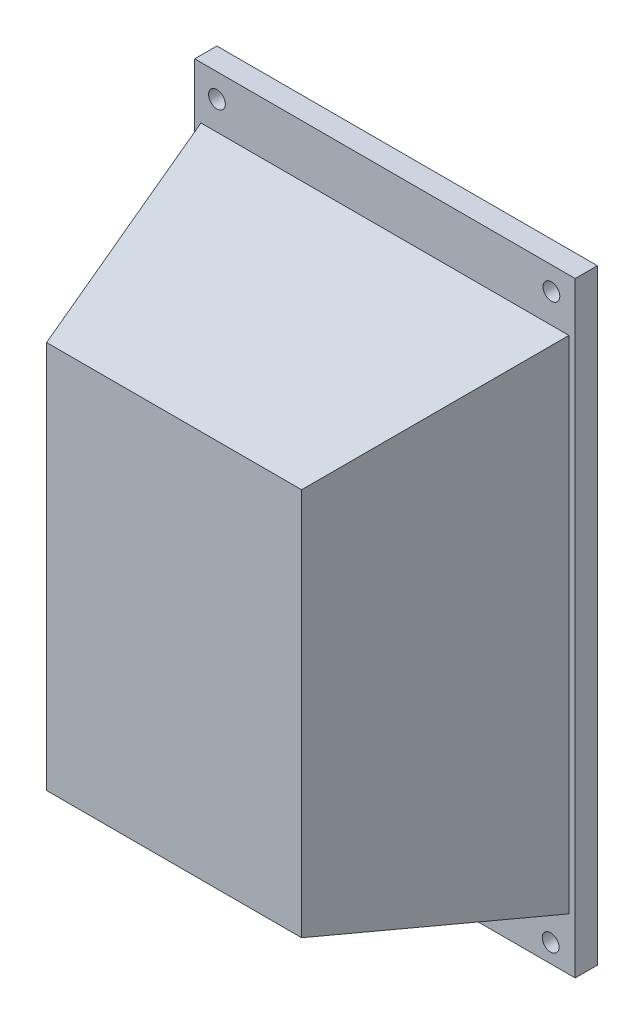
from build123d import *

# Parameters (mm, degrees)
SKETCH1_W                 = 34.29304938
SKETCH1_H                 = 54.588935748
BOSS_EXTRUDE1_DEPTH       = 2
SKETCH3_W                 = 33.162023886
SKETCH3_H                 = 45.144780362
BOSS_EXTRUDE3_DEPTH       = 19
BOSS_EXTRUDE3_TAPER       = 15
F_1_64_TAPPED_HOLE1_D     = 1.5113
F_1_64_TAPPED_HOLE1_DEPTH = 4.89712
F_1_64_TAPPED_HOLE1_TIP   = 0.454040327
SCALE2_SCALE              = 0.5
SCALE5_SCALE              = 0.5


with BuildPart() as part:
    # Sketch1 → Boss-Extrude1 (new body)
    with BuildSketch(Plane.XY):
        Rectangle(SKETCH1_W, SKETCH1_H)
    extrude(amount=BOSS_EXTRUDE1_DEPTH)

    # Sketch3 → Boss-Extrude3 (add)
    with BuildSketch(Plane.XY.offset(2)):
        Rectangle(SKETCH3_W, SKETCH3_H)
    extrude(amount=BOSS_EXTRUDE3_DEPTH, taper=BOSS_EXTRUDE3_TAPER)

    # #1-64 Tapped Hole1
    with Locations(Plane(origin=(15.000680777, 25.209477417, 2), x_dir=(1, 0, 0), z_dir=(0, 0, 1))):
        with Locations((0, 0), (-30.140256747, -0.069447596), (-30.487494728, -50.905088008), (-0.069447596, -50.835640411)):
            Hole(F_1_64_TAPPED_HOLE1_D / 2, depth=F_1_64_TAPPED_HOLE1_DEPTH)
            with Locations((0, 0, -(F_1_64_TAPPED_HOLE1_DEPTH + F_1_64_TAPPED_HOLE1_TIP / 2))):  # 118° drill point
                Cone(0, F_1_64_TAPPED_HOLE1_D / 2, F_1_64_TAPPED_HOLE1_TIP, mode=Mode.SUBTRACT)


with BuildPart() as part_1:
    # Scale2: scaled about (0, 0, 0)
    add(part.part.scale(SCALE2_SCALE))


with BuildPart() as part_2:
    # Scale5: scaled about (0, 0, 0)
    add(part_1.part.scale(SCALE5_SCALE))


solid = part_2.part
